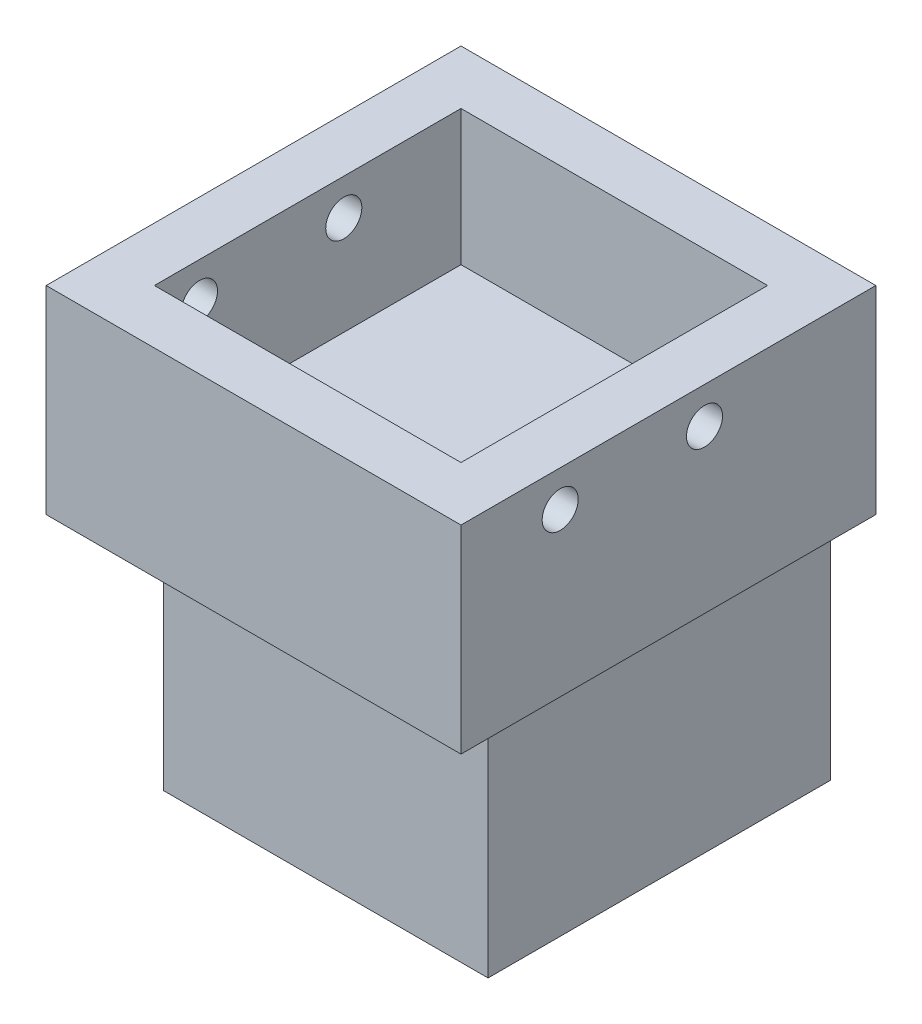
from build123d import *

# Parameters (mm, degrees)
SKETCH1_W           = 23
SKETCH1_H           = 23
BOSS_EXTRUDE1_DEPTH = 11
SKETCH2_W           = 17
SKETCH2_H           = 17
CUT_EXTRUDE1_DEPTH  = 7.5
SKETCH3_W           = 18
SKETCH3_H           = 19
BOSS_EXTRUDE2_DEPTH = 14
SKETCH4_R           = 1
CUT_EXTRUDE2_DEPTH  = 23


with BuildPart() as part:
    # Sketch1 → Boss-Extrude1 (new body)
    with BuildSketch(Plane(origin=(0, 0, 0), x_dir=(1, 0, 0), z_dir=(0, 1, 0))):
        with Locations((10.331746032, -10.598253968)):
            Rectangle(SKETCH1_W, SKETCH1_H)
    extrude(amount=-BOSS_EXTRUDE1_DEPTH)

    # Sketch2 → Cut-Extrude1 (cut)
    with BuildSketch(Plane(origin=(0, 0, 0), x_dir=(1, 0, 0), z_dir=(0, 1, 0))):
        with Locations((10.331746032, -10.598253968)):
            Rectangle(SKETCH2_W, SKETCH2_H)
    extrude(amount=-CUT_EXTRUDE1_DEPTH, mode=Mode.SUBTRACT)

    # Sketch3 → Boss-Extrude2 (add)
    with BuildSketch(Plane.XZ.offset(11)):
        with Locations((10.331746032, 8.598253968)):
            Rectangle(SKETCH3_W, SKETCH3_H)
    extrude(amount=BOSS_EXTRUDE2_DEPTH)

    # Sketch4 → Cut-Extrude2 (cut)
    with BuildSketch(Plane.ZY.offset(1.168253968)):
        with Locations((8.598253968, -2.006935825)):
            Circle(SKETCH4_R)
        with Locations((16.598253968, -2.006935825)):
            Circle(SKETCH4_R)
    extrude(amount=-CUT_EXTRUDE2_DEPTH, mode=Mode.SUBTRACT)


solid = part.part
